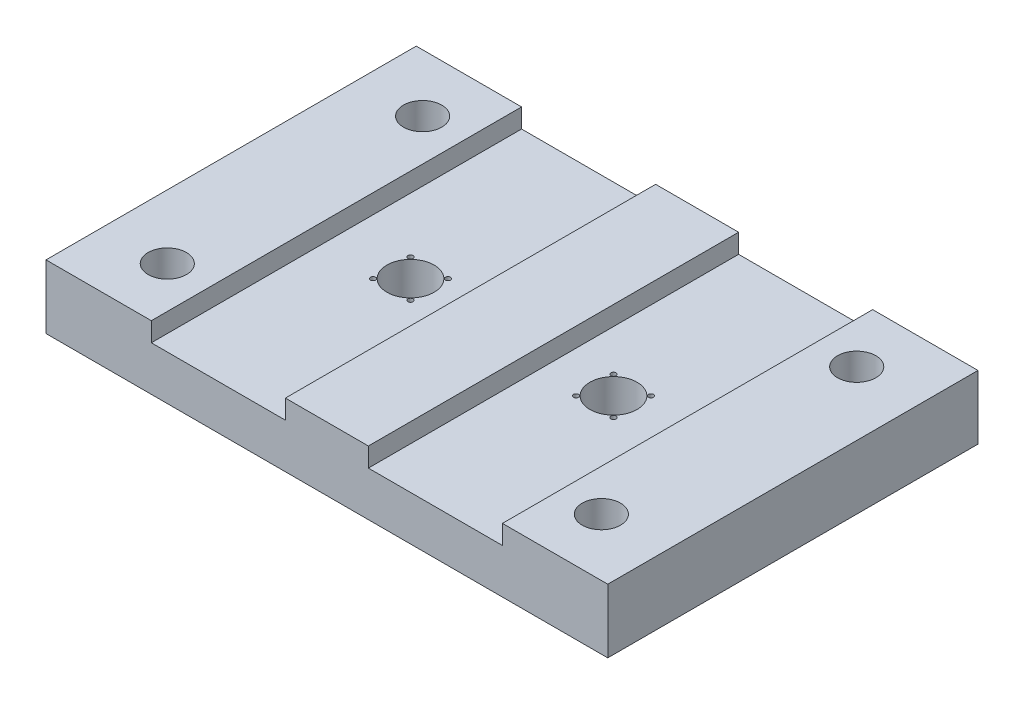
from build123d import *

# Parameters (mm, degrees)
SKETCH1_W               = 880
SKETCH1_H               = 580
BOSS_EXTRUDE1_DEPTH     = 100
SKETCH2_W               = 160
SKETCH2_H               = 580
CUT_EXTRUDE1_DEPTH      = 30
SKETCH3_W               = 210
SKETCH3_H               = 580
CUT_EXTRUDE2_DEPTH      = 30
SKETCH4_R               = 37
CUT_EXTRUDE3_DEPTH      = 264
SKETCH6_R               = 30
CUT_EXTRUDE5_DEPTH      = 271
SKETCH7_R               = 35
CUT_EXTRUDE6_DEPTH      = 10
SKETCH9_R               = 4
CUT_EXTRUDE14_DEPTH     = 500
CIRPATTERN2_COUNT       = 4
MIRROR2_COPY_1_SKETCH_R = 4
MIRROR2_COPY_1_DEPTH    = 500
MIRROR2_COPY_2_SKETCH_R = 4
MIRROR2_COPY_2_DEPTH    = 500
MIRROR2_COPY_3_SKETCH_R = 4
MIRROR2_COPY_3_DEPTH    = 500
MIRROR2_COPY_4_SKETCH_R = 4
MIRROR2_COPY_4_DEPTH    = 500


with BuildPart() as part:
    # Sketch1 → Boss-Extrude1 (new body)
    with BuildSketch(Plane(origin=(0, 0, 0), x_dir=(1, 0, 0), z_dir=(0, 1, 0))):
        Rectangle(SKETCH1_W, SKETCH1_H)
    extrude(amount=BOSS_EXTRUDE1_DEPTH)

    # Sketch2 → Cut-Extrude1 (cut)
    with BuildSketch(Plane(origin=(0, 100, 0), x_dir=(1, 0, 0), z_dir=(0, 1, 0))):
        with Locations((-145, 0)):
            Rectangle(SKETCH2_W, SKETCH2_H)
        with Locations((145, 0)):
            Rectangle(SKETCH2_W, SKETCH2_H)
    extrude(amount=-CUT_EXTRUDE1_DEPTH, mode=Mode.SUBTRACT)

    # Sketch3 → Cut-Extrude2 (cut)
    with BuildSketch(Plane(origin=(0, 100, 0), x_dir=(1, 0, 0), z_dir=(0, 1, 0))):
        with Locations((170, 0)):
            Rectangle(SKETCH3_W, SKETCH3_H)
        with Locations((-170, 0)):
            Rectangle(SKETCH3_W, SKETCH3_H)
    extrude(amount=-CUT_EXTRUDE2_DEPTH, mode=Mode.SUBTRACT)

    # Sketch4 → Cut-Extrude3 (cut)
    with BuildSketch(Plane(origin=(0, 70, 0), x_dir=(1, 0, 0), z_dir=(0, 1, 0))):
        with Locations((-159, 0)):
            Circle(SKETCH4_R)
        with Locations((159, 0)):
            Circle(SKETCH4_R)
    extrude(amount=-CUT_EXTRUDE3_DEPTH, mode=Mode.SUBTRACT)

    # Sketch6 → Cut-Extrude5 (cut)
    with BuildSketch(Plane(origin=(0, 100, 0), x_dir=(1, 0, 0), z_dir=(0, 1, 0))):
        with Locations((-340, 200)):
            Circle(SKETCH6_R)
        with Locations((340, 200)):
            Circle(SKETCH6_R)
        with Locations((340, -200)):
            Circle(SKETCH6_R)
        with Locations((-340, -200)):
            Circle(SKETCH6_R)
    extrude(amount=-CUT_EXTRUDE5_DEPTH, mode=Mode.SUBTRACT)

    # Sketch7 → Cut-Extrude6 (cut)
    with BuildSketch(Plane.XZ):
        with Locations((-340, 200)):
            Circle(SKETCH7_R)
        with Locations((340, 200)):
            Circle(SKETCH7_R)
        with Locations((-340, -200)):
            Circle(SKETCH7_R)
        with Locations((340, -200)):
            Circle(SKETCH7_R)
    extrude(amount=-CUT_EXTRUDE6_DEPTH, mode=Mode.SUBTRACT)

    # Sketch9 → Cut-Extrude14 (cut)
    with BuildSketch(Plane.XZ):
        with Locations((-129.655068581, 29.344931419)):
            Circle(SKETCH9_R)
    cut_extrude14 = extrude(amount=-CUT_EXTRUDE14_DEPTH, mode=Mode.SUBTRACT)

    # CirPattern2: Cut-Extrude14 ×4 about axis
    cirpattern2_axis = Axis((-159, 0, 0), (0, 1, 0))
    for i in range(1, CIRPATTERN2_COUNT):
        add(cut_extrude14.rotate(cirpattern2_axis, i * 360 / CIRPATTERN2_COUNT), mode=Mode.SUBTRACT)

    # Mirror2 copy 1 sketch → Mirror2 copy 1 (cut)
    with BuildSketch(Plane(origin=(159, 0, -159), x_dir=(0, 0, -1), z_dir=(0, -1, 0))):
        with Locations((-129.655068581, -29.344931419)):
            Circle(MIRROR2_COPY_1_SKETCH_R)
    extrude(amount=-MIRROR2_COPY_1_DEPTH, mode=Mode.SUBTRACT)

    # Mirror2 copy 2 sketch → Mirror2 copy 2 (cut)
    with BuildSketch(Plane(origin=(318, 0, 0), x_dir=(1, 0, 0), z_dir=(0, -1, 0))):
        with Locations((-129.655068581, -29.344931419)):
            Circle(MIRROR2_COPY_2_SKETCH_R)
    extrude(amount=-MIRROR2_COPY_2_DEPTH, mode=Mode.SUBTRACT)

    # Mirror2 copy 3 sketch → Mirror2 copy 3 (cut)
    with BuildSketch(Plane(origin=(159, 0, 159), x_dir=(0, 0, 1), z_dir=(0, -1, 0))):
        with Locations((-129.655068581, -29.344931419)):
            Circle(MIRROR2_COPY_3_SKETCH_R)
    extrude(amount=-MIRROR2_COPY_3_DEPTH, mode=Mode.SUBTRACT)

    # Mirror2 copy 4 sketch → Mirror2 copy 4 (cut)
    with BuildSketch(Plane(origin=(0, 0, 0), x_dir=(-1, 0, 0), z_dir=(0, -1, 0))):
        with Locations((-129.655068581, -29.344931419)):
            Circle(MIRROR2_COPY_4_SKETCH_R)
    extrude(amount=-MIRROR2_COPY_4_DEPTH, mode=Mode.SUBTRACT)


solid = part.part
